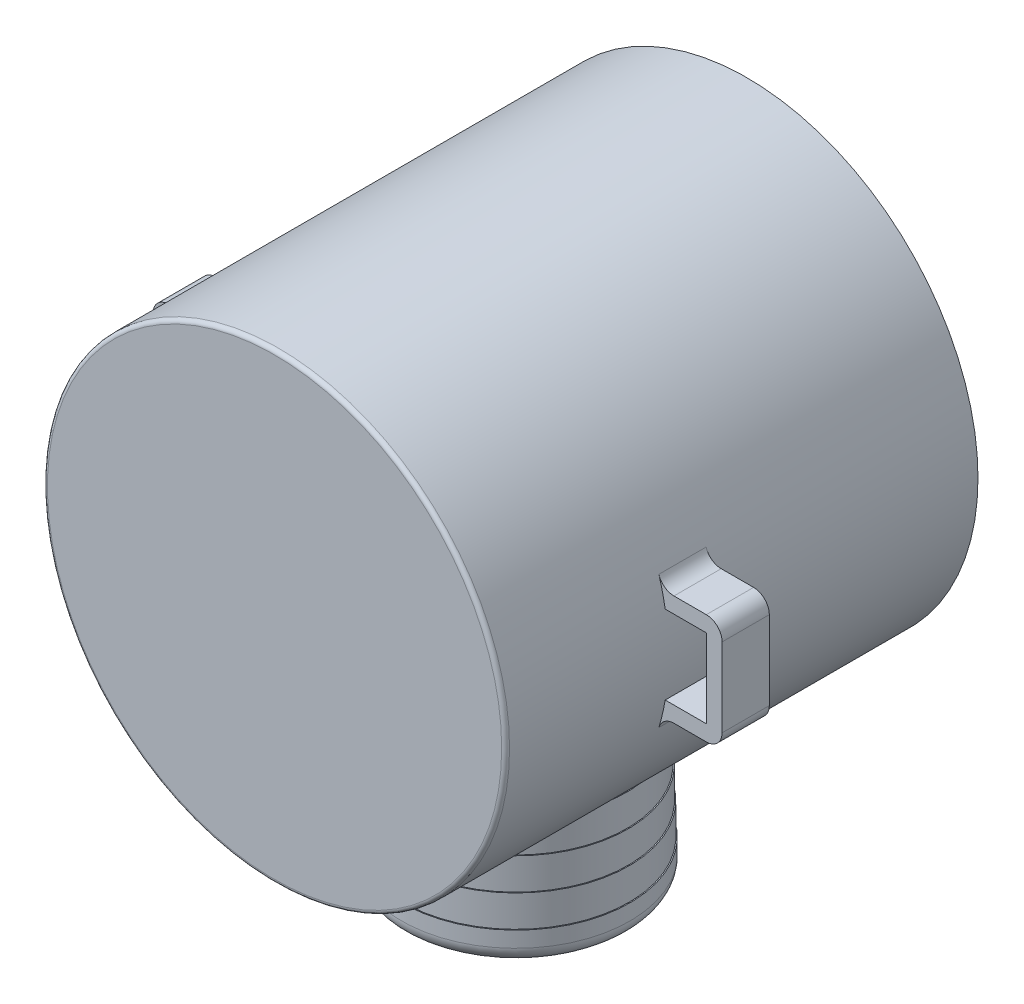
from build123d import *

# Parameters (mm, degrees)
SKETCH1_R           = 29.35
SKETCH1_R_2         = 27.5
BOSS_EXTRUDE1_DEPTH = 60
BOSS_EXTRUDE2_DEPTH = 6
FILLET1_R           = 2
FILLET2_R           = 0.5
BOSS_EXTRUDE3_REACH = 93.389
SKETCH3_R           = 14
SKETCH3_R_2         = 11.5
BOSS_EXTRUDE4_START = 11
SKETCH3_3_R         = 14
SKETCH3_3_R_2       = 11.5
BOSS_EXTRUDE4_DEPTH = 11
BOSS_EXTRUDE5_START = 4
SKETCH4_R           = 14.125
SKETCH4_R_2         = 11.5
BOSS_EXTRUDE5_DEPTH = 4
BOSS_EXTRUDE6_START = 4
SKETCH5_R           = 14.25
SKETCH5_R_2         = 11.5
BOSS_EXTRUDE6_DEPTH = 4
BOSS_EXTRUDE7_START = 4
SKETCH6_R           = 14.375
SKETCH6_R_2         = 11.5
BOSS_EXTRUDE7_DEPTH = 4
BOSS_EXTRUDE8_START = 4
SKETCH7_R           = 14.5
SKETCH7_R_2         = 11.5
BOSS_EXTRUDE8_DEPTH = 4
FILLET3_R           = 2
CUT_EXTRUDE1_REACH  = 112.683
SKETCH8_R           = 11.5
BOSS_EXTRUDE9_START = -0.5
SKETCH9_R           = 27.5
BOSS_EXTRUDE9_DEPTH = 0.5


with BuildPart() as part:
    # Sketch1 → Boss-Extrude1 (new body)
    with BuildSketch(Plane.XY):
        Circle(SKETCH1_R)
        Circle(SKETCH1_R_2, mode=Mode.SUBTRACT)
    extrude(amount=BOSS_EXTRUDE1_DEPTH)

    # Sketch2 → Boss-Extrude2 (add)
    with BuildSketch(Plane.XY.offset(33.3)):
        with BuildLine():
            Line((-28.503026155, 7), (-36.143026155, 7))
            Line((-36.143026155, 7), (-36.143026155, -7))
            Line((-36.143026155, -7), (-28.503026155, -7))
            ThreePointArc((-28.503026155, -7), (-28.729407073, -6.003638001), (-28.920969901, -5))
            Line((-28.920969901, -5), (-34.143026155, -5))
            Line((-34.143026155, -5), (-34.143026155, 5))
            Line((-34.143026155, 5), (-28.920969901, 5))
            ThreePointArc((-28.920969901, 5), (-28.729407073, 6.003638001), (-28.503026155, 7))
        make_face()
        with BuildLine():
            Line((28.503026155, 7), (36.143026155, 7))
            Line((36.143026155, 7), (36.143026155, -7))
            Line((36.143026155, -7), (28.503026155, -7))
            ThreePointArc((28.503026155, -7), (28.729407073, -6.003638001), (28.920969901, -5))
            Line((28.920969901, -5), (34.143026155, -5))
            Line((34.143026155, -5), (34.143026155, 5))
            Line((34.143026155, 5), (28.920969901, 5))
            ThreePointArc((28.920969901, 5), (28.729407073, 6.003638001), (28.503026155, 7))
        make_face()
    extrude(amount=BOSS_EXTRUDE2_DEPTH)

    # Fillet1
    fillet1_edges = [part.edges().sort_by_distance(p)[0] for p in [
        (-28.503026155, 7, 36.3),
        (-36.143026155, 7, 36.3),
        (-36.143026155, -7, 36.3),
        (-28.503026155, -7, 36.3),
        (28.503026155, -7, 36.3),
        (36.143026155, -7, 36.3),
        (36.143026155, 7, 36.3),
        (28.503026155, 7, 36.3),
    ]]
    fillet(fillet1_edges, radius=FILLET1_R)

    # Fillet2
    fillet2_edges = [part.edges().sort_by_distance(p)[0] for p in [
        (-29.35, 0, 60),
    ]]
    fillet(fillet2_edges, radius=FILLET2_R)

    # Sketch3 → Boss-Extrude3 (add, up to next)
    with BuildSketch(Plane(origin=(0, -29.35, 0), x_dir=(-1, 0, 0), z_dir=(0, -1, 0)), mode=Mode.PRIVATE) as boss_extrude3_sk1:
        with Locations((12.85, -16.5)):
            Circle(SKETCH3_R)
        with Locations(Location((12.85, -16.5, 0), (0, 0, 90))):
            Circle(SKETCH3_R_2, mode=Mode.SUBTRACT)
    boss_extrude3_tool1 = extrude(boss_extrude3_sk1.sketch, amount=-BOSS_EXTRUDE3_REACH, mode=Mode.PRIVATE) - part.part
    add(boss_extrude3_tool1.solids().sort_by_distance((0.75402, -29.35, 16.5))[0])
    add(boss_extrude3_tool1.solids().sort_by_distance((0.75402, -29.35, 16.5))[1])

    # Sketch3<3> → Boss-Extrude4 (add)
    with BuildSketch(Plane(origin=(0, -29.35, 0), x_dir=(-1, 0, 0), z_dir=(0, -1, 0)).offset(BOSS_EXTRUDE4_START)):
        with Locations(Location((12.85, -16.5, 0), (0, 0, 90))):
            Circle(SKETCH3_3_R)
        with Locations(Location((12.85, -16.5, 0), (0, 0, 90))):
            Circle(SKETCH3_3_R_2, mode=Mode.SUBTRACT)
    extrude(amount=-BOSS_EXTRUDE4_DEPTH)

    # Sketch4 → Boss-Extrude5 (add)
    with BuildSketch(Plane(origin=(0, -40.35, 0), x_dir=(-1, 0, 0), z_dir=(0, -1, 0)).offset(BOSS_EXTRUDE5_START)):
        with Locations(Location((12.85, -16.5, 0), (0, 0, 90))):
            Circle(SKETCH4_R)
        with Locations(Location((12.85, -16.5, 0), (0, 0, 90))):
            Circle(SKETCH4_R_2, mode=Mode.SUBTRACT)
    extrude(amount=-BOSS_EXTRUDE5_DEPTH)

    # Sketch5 → Boss-Extrude6 (add)
    with BuildSketch(Plane.XZ.offset(44.35).offset(BOSS_EXTRUDE6_START)):
        with Locations(Location((-12.85, 16.5, 0), (0, 0, 270))):
            Circle(SKETCH5_R)
        with Locations(Location((-12.85, 16.5, 0), (0, 0, 270))):
            Circle(SKETCH5_R_2, mode=Mode.SUBTRACT)
    extrude(amount=-BOSS_EXTRUDE6_DEPTH)

    # Sketch6 → Boss-Extrude7 (add)
    with BuildSketch(Plane.XZ.offset(48.35).offset(BOSS_EXTRUDE7_START)):
        with Locations(Location((-12.85, 16.5, 0), (0, 0, 270))):
            Circle(SKETCH6_R)
        with Locations(Location((-12.85, 16.5, 0), (0, 0, 270))):
            Circle(SKETCH6_R_2, mode=Mode.SUBTRACT)
    extrude(amount=-BOSS_EXTRUDE7_DEPTH)

    # Sketch7 → Boss-Extrude8 (add)
    with BuildSketch(Plane(origin=(0, -52.35, 0), x_dir=(-1, 0, 0), z_dir=(0, -1, 0)).offset(BOSS_EXTRUDE8_START)):
        with Locations(Location((12.85, -16.5, 0), (0, 0, 90))):
            Circle(SKETCH7_R)
        with Locations(Location((12.85, -16.5, 0), (0, 0, 90))):
            Circle(SKETCH7_R_2, mode=Mode.SUBTRACT)
    extrude(amount=-BOSS_EXTRUDE8_DEPTH)

    # Fillet3
    fillet3_edges = [part.edges().sort_by_distance(p)[0] for p in [
        (-12.85, -56.35, 31),
    ]]
    fillet(fillet3_edges, radius=FILLET3_R)

    # Sketch8 → Cut-Extrude1 (cut, up to next)
    with BuildSketch(Plane.XZ.offset(56.35), mode=Mode.PRIVATE) as cut_extrude1_sk1:
        with Locations(Location((-12.85, 16.5, 0), (0, 0, 270))):
            Circle(SKETCH8_R)
    cut_extrude1_tool1 = extrude(cut_extrude1_sk1.sketch, amount=-CUT_EXTRUDE1_REACH, mode=Mode.PRIVATE) & part.part
    add(cut_extrude1_tool1.solids().sort_by_distance((-12.85, -56.35, 16.5))[0], mode=Mode.SUBTRACT)

    # Sketch9 → Boss-Extrude9 (add)
    with BuildSketch(Plane.XY.offset(60).offset(BOSS_EXTRUDE9_START)):
        Circle(SKETCH9_R)
    extrude(amount=BOSS_EXTRUDE9_DEPTH)


solid = part.part
